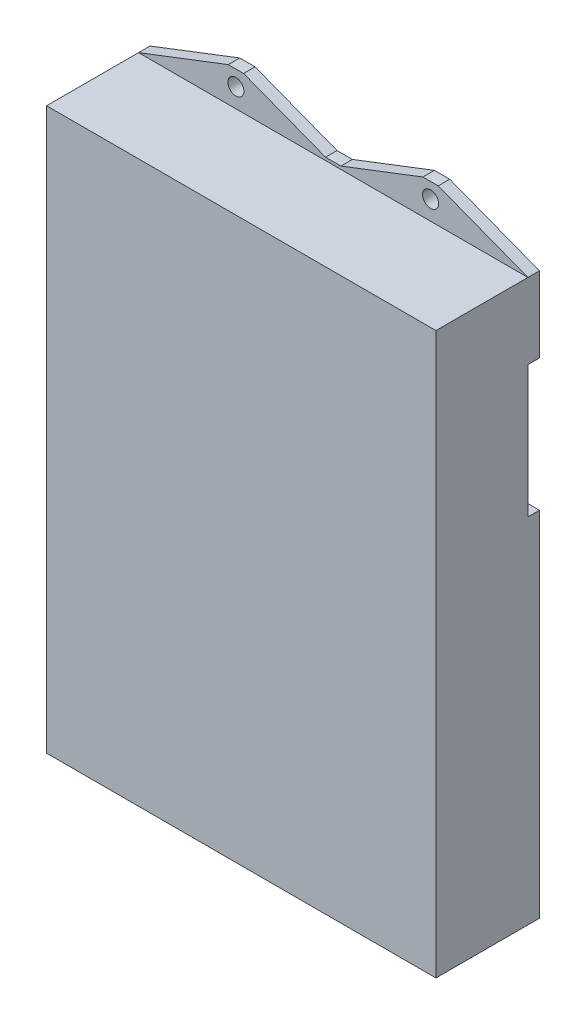
from build123d import *

# Parameters (mm, degrees)
ESQUISSE1_R        = 2.1
ESQUISSE1_R_2      = 1.5
BOSS_EXTRU_1_DEPTH = 3
ESQUISSE2_W        = 101.6
ESQUISSE2_H        = 146.3
BOSS_EXTRU_2_DEPTH = 24


with BuildPart() as part:
    # Esquisse1 → Boss.-Extru.1 (new body)
    with BuildSketch(Plane.XY):
        Polygon((-50.8, 73.15), (-27.4, 82.15), (-23.4, 82.15), (-2, 73.919230769), (2, 73.919230769), (23.4, 82.15), (27.4, 82.15), (50.8, 73.15), (50.8, 53.45), (43.2, 53.45), (43.2, 19.05), (50.8, 19.05), (50.8, -73.15), (27.4, -82.15), (23.4, -82.15), (2, -73.919230769), (-2, -73.919230769), (-23.4, -82.15), (-27.4, -82.15), (-50.8, -73.15), (-50.8, 19.05), (-43.2, 19.05), (-43.2, 53.45), (-50.8, 53.45), align=None)
        with Locations((-25.4, -78.15)):
            Circle(ESQUISSE1_R, mode=Mode.SUBTRACT)
        with Locations(Location((25.4, -78.15, 0), (0, 0, 180))):
            Circle(ESQUISSE1_R, mode=Mode.SUBTRACT)
        with Locations(Location((-25.4, 78.15, 0), (0, 0, 180))):
            Circle(ESQUISSE1_R, mode=Mode.SUBTRACT)
        with Locations((25.4, 78.15)):
            Circle(ESQUISSE1_R, mode=Mode.SUBTRACT)
        with Locations((-48.1, -69.85)):
            Circle(ESQUISSE1_R_2, mode=Mode.SUBTRACT)
        with Locations(Location((48.1, -69.85, 0), (0, 0, 180))):
            Circle(ESQUISSE1_R_2, mode=Mode.SUBTRACT)
        with Locations(Location((-48.1, 69.85, 0), (0, 0, 180))):
            Circle(ESQUISSE1_R_2, mode=Mode.SUBTRACT)
        with Locations((48.1, 69.85)):
            Circle(ESQUISSE1_R_2, mode=Mode.SUBTRACT)
    extrude(amount=BOSS_EXTRU_1_DEPTH)

    # Esquisse2 → Boss.-Extru.2 (add)
    with BuildSketch(Plane.XY.offset(3)):
        Rectangle(ESQUISSE2_W, ESQUISSE2_H)
    extrude(amount=BOSS_EXTRU_2_DEPTH)


solid = part.part
